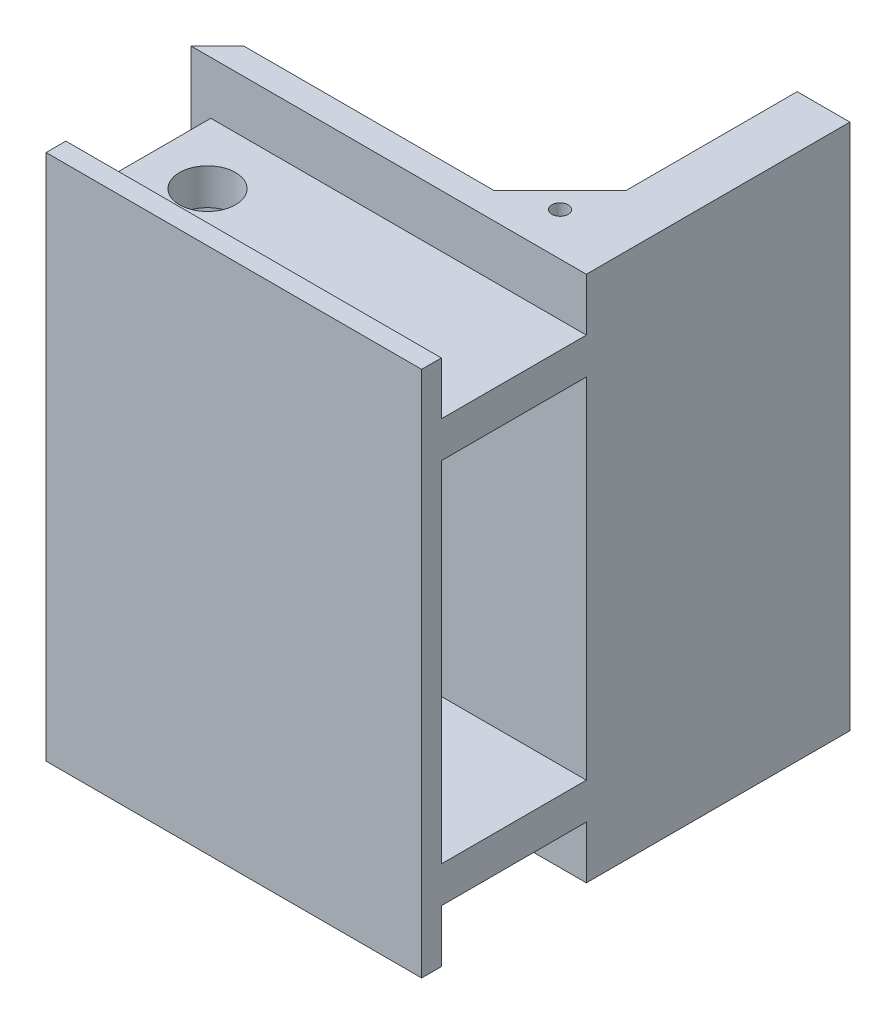
from build123d import *

# Parameters (mm, degrees)
SKETCH1_W           = 20
SKETCH1_H           = 40
BOSS_EXTRUDE1_DEPTH = 80
SKETCH8_W           = 25
SKETCH8_H           = 64
BOSS_EXTRUDE2_DEPTH = 57
SKETCH12_W          = 57
SKETCH12_H          = 6
BOSS_EXTRUDE3_DEPTH = 8
SKETCH14_W          = 57
SKETCH14_H          = 6
BOSS_EXTRUDE4_DEPTH = 8
SKETCH17_W          = 48
SKETCH17_H          = 80
CUT_EXTRUDE4_DEPTH  = 36
CHAMFER1_SIZE       = 10
SKETCH16_W          = 48
SKETCH16_H          = 72
CUT_EXTRUDE5_DEPTH  = 10
SKETCH19_R          = 1.25
CUT_EXTRUDE6_DEPTH  = 109.102562738
SKETCH21_W          = 19
SKETCH21_H          = 53
CUT_EXTRUDE7_DEPTH  = 108.916413596
SKETCH22_R          = 4.25
CUT_EXTRUDE8_DEPTH  = 103.323819663
SKETCH25_W          = 3
SKETCH25_H          = 8
SKETCH25_H_2        = 53
CUT_EXTRUDE11_DEPTH = 108.916413596


with BuildPart() as part:
    # Sketch1 → Boss-Extrude1 (new body)
    with BuildSketch(Plane(origin=(0, 0, 0), x_dir=(1, 0, 0), z_dir=(0, 1, 0))):
        Polygon((-17.351649908, 20.312727502), (-57.351649908, -19.687272498), (-17.351649908, -19.687272498), align=None)
        with Locations((-7.351649908, 0.312727502)):
            Rectangle(SKETCH1_W, SKETCH1_H)
    extrude(amount=-BOSS_EXTRUDE1_DEPTH)

    # Sketch8 → Boss-Extrude2 (add)
    with BuildSketch(Plane(origin=(2.648350092, 0, 0), x_dir=(0, 0, -1), z_dir=(1, 0, 0))):
        with Locations((-32.187272498, -40)):
            Rectangle(SKETCH8_W, SKETCH8_H)
    extrude(amount=-BOSS_EXTRUDE2_DEPTH)

    # Sketch12 → Boss-Extrude3 (add)
    with BuildSketch(Plane.XZ.offset(72)):
        with Locations((-25.851649908, 41.687272498)):
            Rectangle(SKETCH12_W, SKETCH12_H)
    extrude(amount=BOSS_EXTRUDE3_DEPTH)

    # Sketch14 → Boss-Extrude4 (add)
    with BuildSketch(Plane(origin=(0, -8, 0), x_dir=(1, 0, 0), z_dir=(0, 1, 0))):
        with Locations((-25.851649908, -41.687272498)):
            Rectangle(SKETCH14_W, SKETCH14_H)
    extrude(amount=BOSS_EXTRUDE4_DEPTH)

    # Sketch17 → Cut-Extrude4 (cut)
    with BuildSketch(Plane(origin=(0, 0, -20.312727502), x_dir=(-1, 0, 0), z_dir=(0, 0, -1))):
        with Locations((29.351649908, -40)):
            Rectangle(SKETCH17_W, SKETCH17_H)
    extrude(amount=-CUT_EXTRUDE4_DEPTH, mode=Mode.SUBTRACT)

    # Chamfer1
    chamfer1_edges = [part.edges().sort_by_distance(p)[0] for p in [
        (-5.351649908, -40, 15.687272498),
    ]]
    chamfer(chamfer1_edges, length=CHAMFER1_SIZE)

    # Sketch16 → Cut-Extrude5 (cut)
    with BuildSketch(Plane(origin=(0, 0, 15.687272498), x_dir=(-1, 0, 0), z_dir=(0, 0, -1))):
        with Locations((29.351649908, -40)):
            Rectangle(SKETCH16_W, SKETCH16_H)
    extrude(amount=CUT_EXTRUDE5_DEPTH, mode=Mode.SUBTRACT)

    # Sketch19 → Cut-Extrude6 (cut, through all)
    with BuildSketch(Plane(origin=(0, 0, 0), x_dir=(1, 0, 0), z_dir=(0, 1, 0))):
        with Locations(Location((-7.851649908, -13.187272498, 0), (0, 0, 270))):
            Circle(SKETCH19_R)
    extrude(amount=-CUT_EXTRUDE6_DEPTH, mode=Mode.SUBTRACT)

    # Sketch21 → Cut-Extrude7 (cut, through all)
    with BuildSketch(Plane.ZY.offset(54.351649908)):
        with Locations((29.187272498, -40)):
            Rectangle(SKETCH21_W, SKETCH21_H)
    extrude(amount=-CUT_EXTRUDE7_DEPTH, mode=Mode.SUBTRACT)

    # Sketch22 → Cut-Extrude8 (cut, through all)
    with BuildSketch(Plane.XZ.offset(72)):
        with Locations(Location((-45.351649908, 29.187272498, 0), (0, 0, 270))):
            Circle(SKETCH22_R)
    extrude(amount=-CUT_EXTRUDE8_DEPTH, mode=Mode.SUBTRACT)

    # Sketch25 → Cut-Extrude11 (cut, through all)
    with BuildSketch(Plane.ZY.offset(54.351649908)):
        with Locations((40.187272498, -76)):
            Rectangle(SKETCH25_W, SKETCH25_H)
        with Locations((40.187272498, -40)):
            Rectangle(SKETCH25_W, SKETCH25_H_2)
        with Locations((40.187272498, -4)):
            Rectangle(SKETCH25_W, SKETCH25_H)
    extrude(amount=-CUT_EXTRUDE11_DEPTH, mode=Mode.SUBTRACT)


solid = part.part
